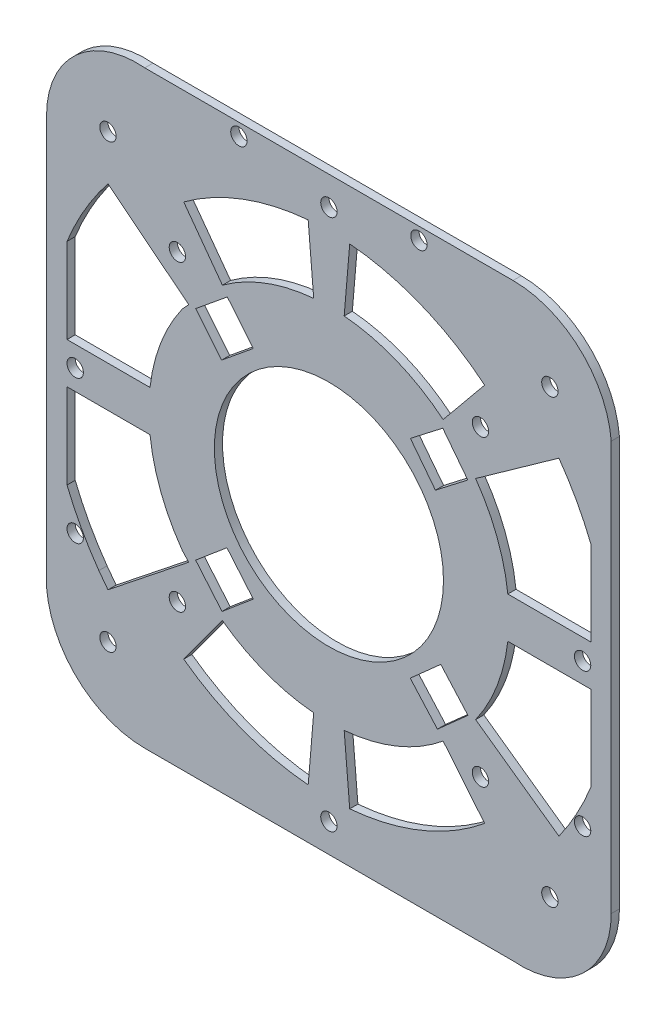
from build123d import *

# Parameters (mm, degrees)
SKETCH1_W           = 90
SKETCH1_H           = 100
SKETCH1_H_2         = 22
SKETCH1_W_2         = 24
BOSS_EXTRUDE1_DEPTH = 2
CUT_EXTRUDE1_DEPTH  = 10
CUT_EXTRUDE2_DEPTH  = 10
SKETCH4_R           = 30
CUT_EXTRUDE3_DEPTH  = 10
CUT_EXTRUDE4_DEPTH  = 10
CUT_EXTRUDE5_DEPTH  = 10
BOSS_EXTRUDE3_START = -2
SKETCH8_R           = 30
SKETCH8_R_2         = 28
BOSS_EXTRUDE3_DEPTH = 2
SKETCH9_R           = 2
CUT_EXTRUDE6_DEPTH  = 10
SKETCH10_R          = 2
BOSS_EXTRUDE4_DEPTH = 2
SKETCH11_R          = 2
CUT_EXTRUDE7_DEPTH  = 10
SKETCH12_R          = 2
BOSS_EXTRUDE5_DEPTH = 2
SKETCH13_R          = 2
CUT_EXTRUDE8_DEPTH  = 5


with BuildPart() as part:
    # Sketch1 → Boss-Extrude1 (new body)
    with BuildSketch(Plane.XY):
        Rectangle(SKETCH1_W, SKETCH1_H)
        with Locations((0, 61)):
            Rectangle(SKETCH1_W, SKETCH1_H_2)
        with Locations((57, 0)):
            Rectangle(SKETCH1_W_2, SKETCH1_H)
        with BuildLine():
            Line((45, 50), (69, 50))
            ThreePointArc((69, 50), (61.278820596, 65.667804287), (45, 72))
            Line((45, 72), (45, 50))
        make_face()
        with BuildLine():
            ThreePointArc((45, -72), (61.83891888, -66.278820596), (69, -50))
            Line((69, -50), (45, -50))
            Line((45, -50), (45, -72))
        make_face()
        with Locations((0, -61)):
            Rectangle(SKETCH1_W, SKETCH1_H_2)
        with BuildLine():
            Line((-45, -72), (-45, -50))
            Line((-45, -50), (-69, -50))
            ThreePointArc((-69, -50), (-61.278820596, -65.667804287), (-45, -72))
        make_face()
        with Locations((-57, 0)):
            Rectangle(SKETCH1_W_2, SKETCH1_H)
        with BuildLine():
            Line((-69, 50), (-45, 50))
            Line((-45, 50), (-45, 72))
            ThreePointArc((-45, 72), (-61.83891888, 66.278820596), (-69, 50))
        make_face()
    extrude(amount=BOSS_EXTRUDE1_DEPTH)

    # Sketch2 → Cut-Extrude1 (cut)
    with BuildSketch(Plane.XY.offset(2)):
        with BuildLine():
            Line((-60.760739313, 25.787593916), (-64, 15.649215929))
            Line((-64, 15.649215929), (-64, 5))
            Line((-64, 5), (-43.724760028, 5))
            ThreePointArc((-43.724760028, 5), (-41.091915324, 15.757827722), (-35.856683042, 25.517698186))
            Line((-35.856683042, 25.517698186), (-56.217391304, 40.007560722))
            ThreePointArc((-56.217391304, 40.007560722), (-60.52773874, 33.126920216), (-64, 25.787593916))
            Line((-64, 25.787593916), (-60.760739313, 25.787593916))
        make_face()
        with BuildLine():
            Line((-64, -5), (-64, -25.787593916))
            ThreePointArc((-64, -25.787593916), (-60.52773874, -33.126920216), (-56.217391304, -40.007560722))
            Line((-56.217391304, -40.007560722), (-35.856683042, -25.517698186))
            ThreePointArc((-35.856683042, -25.517698186), (-41.091915324, -15.757827722), (-43.724760028, -5))
            Line((-43.724760028, -5), (-64, -5))
        make_face()
        with BuildLine():
            Line((-35.483097289, 48.383362913), (-26.026680798, 35.488963441))
            ThreePointArc((-26.026680798, 35.488963441), (-15.448259809, 41.209293956), (-3.716315379, 43.852521472))
            Line((-3.716315379, 43.852521472), (-5.066584601, 59.785698294))
            ThreePointArc((-5.066584601, 59.785698294), (-21.061160661, 56.182092446), (-35.483097289, 48.383362913))
        make_face()
        with BuildLine():
            ThreePointArc((64, 25.787593916), (60.52773874, 33.126920216), (56.217391304, 40.007560722))
            Line((56.217391304, 40.007560722), (35.856683042, 25.517698186))
            ThreePointArc((35.856683042, 25.517698186), (41.091915324, 15.757827722), (43.724760028, 5))
            Line((43.724760028, 5), (64, 5))
            Line((64, 5), (64, 25.787593916))
        make_face()
        with BuildLine():
            Line((-26.026680798, -35.488963441), (-35.483097289, -48.383362913))
            ThreePointArc((-35.483097289, -48.383362913), (-21.061160661, -56.182092446), (-5.066584601, -59.785698294))
            Line((-5.066584601, -59.785698294), (-3.716315379, -43.852521472))
            ThreePointArc((-3.716315379, -43.852521472), (-15.448259809, -41.209293956), (-26.026680798, -35.488963441))
        make_face()
        with BuildLine():
            ThreePointArc((56.217391304, -40.007560722), (60.52773874, -33.126920216), (64, -25.787593916))
            Line((64, -25.787593916), (64, -5))
            Line((64, -5), (43.724760028, -5))
            ThreePointArc((43.724760028, -5), (41.091915324, -15.757827722), (35.856683042, -25.517698186))
            Line((35.856683042, -25.517698186), (56.217391304, -40.007560722))
        make_face()
        with BuildLine():
            Line((27.916279909, 34.022580083), (38.059254795, 46.384190458))
            ThreePointArc((38.059254795, 46.384190458), (22.588514074, 55.585600941), (5.084745763, 59.784156434))
            Line((5.084745763, 59.784156434), (3.729636503, 43.851390526))
            ThreePointArc((3.729636503, 43.851390526), (16.568566174, 40.771770312), (27.916279909, 34.022580083))
        make_face()
        with BuildLine():
            Line((3.729636503, -43.851390526), (5.084745763, -59.784156434))
            ThreePointArc((5.084745763, -59.784156434), (22.588514074, -55.585600941), (38.059254795, -46.384190458))
            Line((38.059254795, -46.384190458), (27.916279909, -34.022580083))
            ThreePointArc((27.916279909, -34.022580083), (16.568566174, -40.771770312), (3.729636503, -43.851390526))
        make_face()
    extrude(amount=-CUT_EXTRUDE1_DEPTH, mode=Mode.SUBTRACT)

    # Sketch3 → Cut-Extrude2 (cut)
    with BuildSketch(Plane.XY.offset(2)):
        Polygon((-64, 25.787593916), (-64, 15.649215929), (-60.760739313, 25.787593916), align=None)
    extrude(amount=-CUT_EXTRUDE2_DEPTH, mode=Mode.SUBTRACT)

    # Sketch4 → Cut-Extrude3 (cut)
    with BuildSketch(Plane(origin=(0, 0, 0), x_dir=(-1, 0, 0), z_dir=(0, 0, -1))):
        Circle(SKETCH4_R)
    extrude(amount=-CUT_EXTRUDE3_DEPTH, mode=Mode.SUBTRACT)

    # Sketch6 → Cut-Extrude4 (cut)
    with BuildSketch(Plane.XY.offset(2)):
        Polygon((-35.856683042, -25.517698186), (-56.217391304, -40.007560722), (-50.280397209, -40.007560722), (-34.257403731, -27.258240508), align=None)
        Polygon((-50.280397209, 40.007560722), (-56.217391304, 40.007560722), (-35.856683042, 25.517698186), (-34.257403731, 27.258240508), align=None)
        Polygon((-50.280397209, -40.007560722), (-56.217391304, -40.007560722), (-53.993303971, -42.96187992), align=None)
        Polygon((-53.993303971, 42.96187992), (-56.217391304, 40.007560722), (-50.280397209, 40.007560722), align=None)
    extrude(amount=-CUT_EXTRUDE4_DEPTH, mode=Mode.SUBTRACT)

    # Sketch7 → Cut-Extrude5 (cut)
    with BuildSketch(Plane.XY.offset(2)):
        Polygon((-32.560271117, 27.267561972), (-24.823321267, 33.603144582), (-18.487738656, 25.866194731), (-26.224688507, 19.530612121), align=None)
        Polygon((27.827762823, 32.155388995), (19.915267174, 26.040455421), (26.030200748, 18.127959772), (33.942696396, 24.242893346), align=None)
        Polygon((33.988304577, -25.549058378), (27.336365779, -18.082351592), (19.869658993, -24.734290389), (26.521597791, -32.200997176), align=None)
        Polygon((-26.126682472, -33.612215797), (-18.478667441, -27.169555937), (-24.921327301, -19.521540905), (-32.569342333, -25.964200766), align=None)
    extrude(amount=-CUT_EXTRUDE5_DEPTH, mode=Mode.SUBTRACT)

    # Sketch8 → Boss-Extrude3 (add)
    with BuildSketch(Plane.XY.offset(2).offset(BOSS_EXTRUDE3_START)):
        Circle(SKETCH8_R)
        Circle(SKETCH8_R_2, mode=Mode.SUBTRACT)
    extrude(amount=BOSS_EXTRUDE3_DEPTH)

    # Sketch9 → Cut-Extrude6 (cut)
    with BuildSketch(Plane.XY.offset(2)):
        with Locations((13, 29.149963044)):
            Circle(SKETCH9_R)
        with Locations((-13, 29.149963044)):
            Circle(SKETCH9_R)
        with Locations((-22, 69)):
            Circle(SKETCH9_R)
        with Locations((22, 69)):
            Circle(SKETCH9_R)
        with Locations((62, -36.850036956)):
            Circle(SKETCH9_R)
        with Locations((-62, -36.850036956)):
            Circle(SKETCH9_R)
        with Locations((0, -36.850036956)):
            Circle(SKETCH9_R)
        with Locations((0, 65)):
            Circle(SKETCH9_R)
        with Locations((62, 0)):
            Circle(SKETCH9_R)
        with Locations((-62, 0)):
            Circle(SKETCH9_R)
        with Locations((0, -65)):
            Circle(SKETCH9_R)
        with Locations((-54, 54)):
            Circle(SKETCH9_R)
        with Locations((54, 54)):
            Circle(SKETCH9_R)
        with Locations((54, -54)):
            Circle(SKETCH9_R)
        with Locations((-54, -54)):
            Circle(SKETCH9_R)
        with Locations((-37.029437252, 37.029437252)):
            Circle(SKETCH9_R)
        with Locations((37.029437252, 37.029437252)):
            Circle(SKETCH9_R)
        with Locations((37.029437252, -37.029437252)):
            Circle(SKETCH9_R)
        with Locations((-37.029437252, -37.029437252)):
            Circle(SKETCH9_R)
    extrude(amount=-CUT_EXTRUDE6_DEPTH, mode=Mode.SUBTRACT)

    # Sketch10 → Boss-Extrude4 (add)
    with BuildSketch(Plane.XY.offset(2)):
        with Locations((62, -36.850036956)):
            Circle(SKETCH10_R)
        with Locations((-62, -36.850036956)):
            Circle(SKETCH10_R)
        with Locations((13, 29.149963044)):
            Circle(SKETCH10_R)
        with Locations((-13, 29.149963044)):
            Circle(SKETCH10_R)
        with Locations((0, -36.850036956)):
            Circle(SKETCH10_R)
    extrude(amount=-BOSS_EXTRUDE4_DEPTH)

    # Sketch11 → Cut-Extrude7 (cut)
    with BuildSketch(Plane.XY.offset(2)):
        with Locations((-62, -36)):
            Circle(SKETCH11_R)
        with Locations((62, -36)):
            Circle(SKETCH11_R)
    extrude(amount=-CUT_EXTRUDE7_DEPTH, mode=Mode.SUBTRACT)

    # Sketch12 → Boss-Extrude5 (add)
    with BuildSketch(Plane.XY.offset(2)):
        with Locations((62, -36)):
            Circle(SKETCH12_R)
        with Locations((-62, -36)):
            Circle(SKETCH12_R)
    extrude(amount=-BOSS_EXTRUDE5_DEPTH)

    # Sketch13 → Cut-Extrude8 (cut)
    with BuildSketch(Plane.XY.offset(2)):
        with Locations((62, -35)):
            Circle(SKETCH13_R)
        with Locations((-62, -35)):
            Circle(SKETCH13_R)
    extrude(amount=-CUT_EXTRUDE8_DEPTH, mode=Mode.SUBTRACT)


solid = part.part
